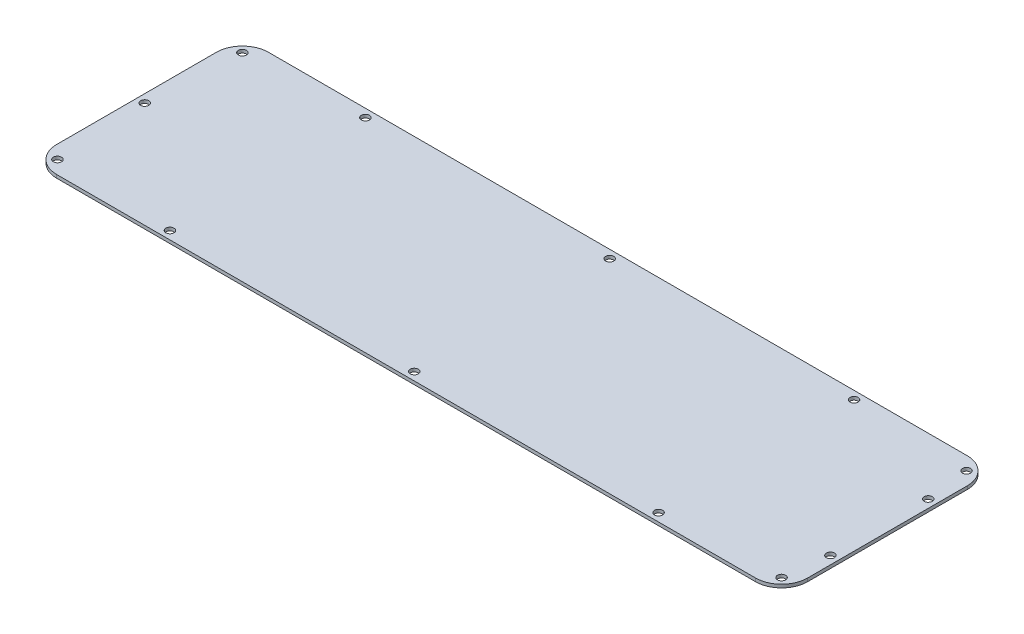
from build123d import *

# Parameters (mm, degrees)
SKETCH1_W                = 461
SKETCH1_H                = 130
BOSS_EXTRUDE1_DEPTH      = 2
FILLET1_R                = 16
F_5_0_5_DIAMETER_HOLE1_D = 5


with BuildPart() as part:
    # Sketch1 → Boss-Extrude1 (new body)
    with BuildSketch(Plane(origin=(0, 0, 0), x_dir=(1, 0, 0), z_dir=(0, 1, 0))):
        Rectangle(SKETCH1_W, SKETCH1_H)
    extrude(amount=BOSS_EXTRUDE1_DEPTH)

    # Fillet1
    fillet1_edges = [part.edges().sort_by_distance(p)[0] for p in [
        (230.5, 1, 65),
        (-230.5, 1, 65),
        (-230.5, 1, -65),
        (230.5, 1, -65),
    ]]
    fillet(fillet1_edges, radius=FILLET1_R)

    # Ø5.0 (5) Diameter Hole1 (through all)
    with Locations(Plane(origin=(-222.278174593, 2, -56.778174593), x_dir=(0, 0, 1), z_dir=(0, 1, 0))):
        with Locations((0, 0), (-3.221825407, 72.278174593), (56.778174593, -3.221825407), (113.556349186, 0), (116.778174593, 72.278174593), (-3.221825407, 222.278174593), (116.778174593, 222.278174593), (116.778174593, 372.278174593), (-3.221825407, 372.278174593), (0, 444.556349186), (113.556349186, 444.556349186), (26.778174593, 447.778174593), (86.778174593, 447.778174593)):
            Hole(F_5_0_5_DIAMETER_HOLE1_D / 2)


solid = part.part
